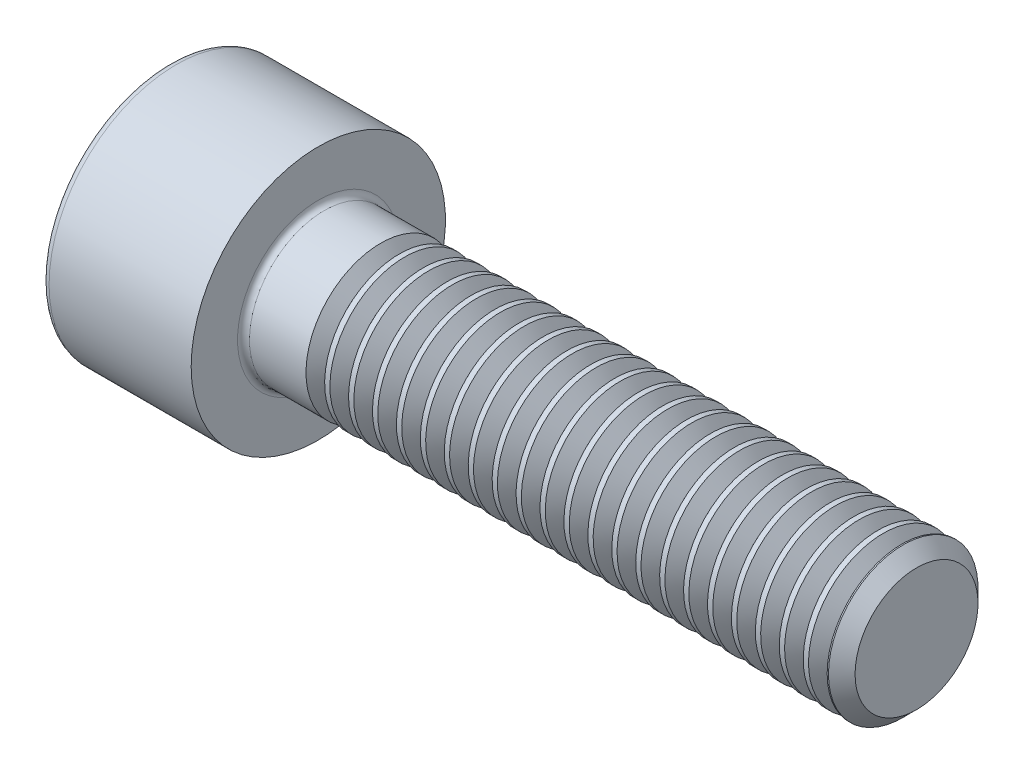
from build123d import *

# Parameters (mm, degrees)
FILLET1_R       = 0.2
FILLET2_R       = 0.25
HEX_2_DEPTH     = 2.5
THDSCHPAT_COUNT = 22
THDSCHPAT_PITCH = 0.8


with BuildPart() as part:
    # BodySke → Base-Revolve (revolve)
    with BuildSketch(Plane.XY, mode=Mode.PRIVATE) as base_revolve_sk:
        Polygon((0, 0), (0, 4.25), (5, 4.25), (5, 2.5), (24.555, 2.5), (25, 2.055), (25, 0), align=None)
    revolve(base_revolve_sk.sketch.rotate(Axis((-31.75, 0, 0), (1, 0, 0)), 90), axis=Axis((-31.75, 0, 0), (1, 0, 0)))

    # Fillet1
    fillet1_edges = [part.edges().sort_by_distance(p)[0] for p in [
        (5, 0, -2.5),
    ]]
    fillet(fillet1_edges, radius=FILLET1_R)

    # Fillet2
    fillet2_edges = [part.edges().sort_by_distance(p)[0] for p in [
        (0, 0, -4.25),
    ]]
    fillet(fillet2_edges, radius=FILLET2_R)

    # Sketch2 → Hex-PreBroach (revolve, cut)
    with BuildSketch(Plane.XY, mode=Mode.PRIVATE) as hex_prebroach_sk:
        Polygon((0, 2.042), (2.5, 2.042), (3.67894925, 0), (0, 0), align=None)
    revolve(hex_prebroach_sk.sketch.rotate(Axis((0, 0, 0), (1, 0, 0)), 90), axis=Axis((0, 0, 0), (1, 0, 0)), mode=Mode.SUBTRACT)

    # Sketch3 → Hex 2 (cut)
    with BuildSketch(Plane(origin=(0, 0, 0), x_dir=(0, 0.500000000000001, 0.866025403784438), z_dir=(-1, 0, 0))):
        Polygon((1.17894925, 2.042), (-1.17894925, 2.042), (-2.357898499, 0), (-1.17894925, -2.042), (1.17894925, -2.042), (2.357898499, 0), align=None)
    extrude(amount=-HEX_2_DEPTH, mode=Mode.SUBTRACT)

    # ThdSchSke → ThreadSchematic (revolve, cut)
    with BuildSketch(Plane.XY):
        Polygon((7.4, -2.055), (7.088407645, -2.5), (7.088407645, -3.125), (7.711592355, -3.125), (7.711592355, -2.5), align=None)
    threadschematic = revolve(axis=Axis((-3.175, 0, 0), (1, 0, 0)), mode=Mode.SUBTRACT)

    # ThdSchPat: ThreadSchematic ×22
    with Locations(*[(i * THDSCHPAT_PITCH, 0, 0) for i in range(1, THDSCHPAT_COUNT)]):
        add(threadschematic, mode=Mode.SUBTRACT)


solid = part.part
